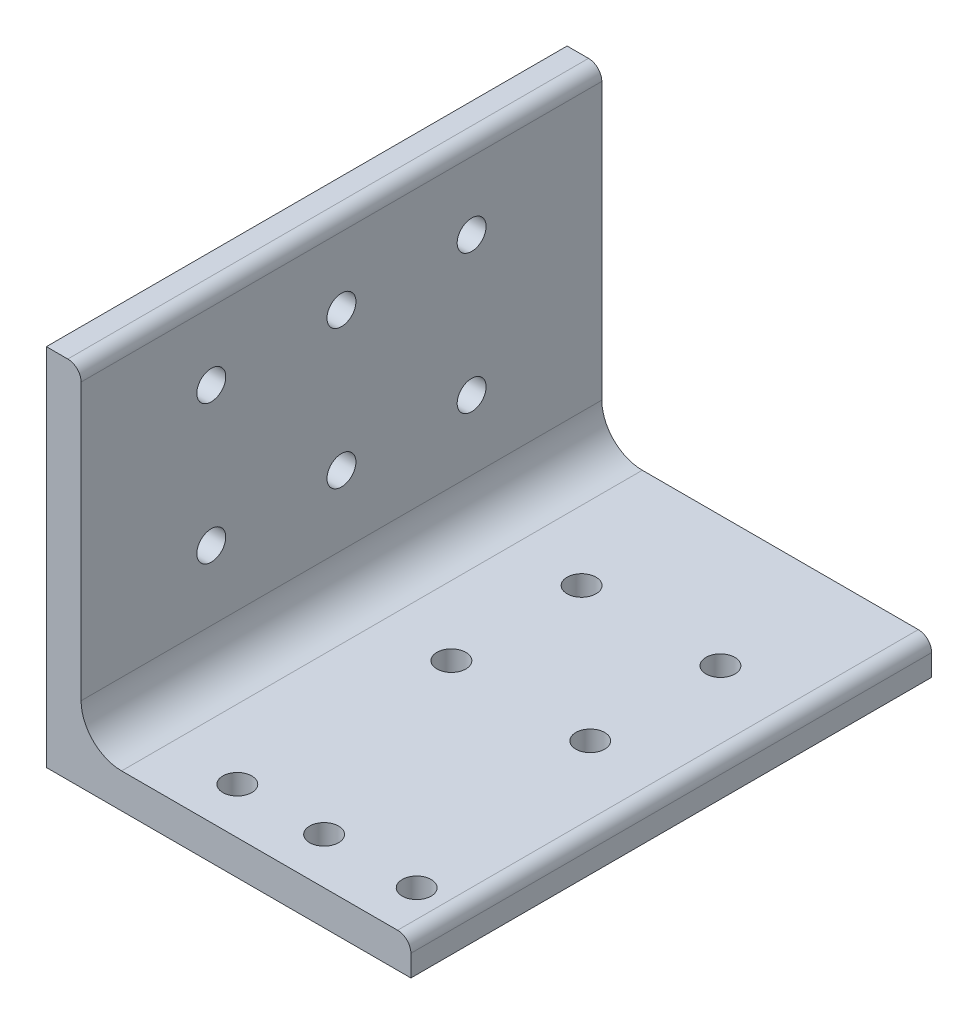
from build123d import *

# Parameters (mm, degrees)
AUFSATZ_LINEAR_AUSTRAGEN1_DEPTH = 90
F_5_0_5_DURCHMESSER_BOHRUNG1_D  = 5
F_5_0_5_DURCHMESSER_BOHRUNG2_D  = 5


with BuildPart() as part:
    # Skizze2 → Aufsatz-Linear austragen1 (new body)
    with BuildSketch(Plane.XY):
        with BuildLine():
            ThreePointArc((6, 13), (8.050252532, 8.050252532), (13, 6))
            Line((13, 6), (60.7, 6))
            ThreePointArc((60.7, 6), (62.326345597, 5.326345597), (63, 3.7))
            Line((63, 3.7), (63, 0))
            Line((63, 0), (0, 0))
            Line((0, 0), (0, 63))
            Line((0, 63), (3.7, 63))
            ThreePointArc((3.7, 63), (5.326345597, 62.326345597), (6, 60.7))
            Line((6, 60.7), (6, 13))
        make_face()
    extrude(amount=AUFSATZ_LINEAR_AUSTRAGEN1_DEPTH)

    # Ø5.0 (5) Durchmesser Bohrung1 (through all)
    with Locations(Plane(origin=(6, 25, 67.5), x_dir=(0, 1, 0), z_dir=(1, 0, 0))):
        with Locations((0, 0), (24, 0), (24, -22.5), (0, -22.5), (0, -45), (24, -45)):
            Hole(F_5_0_5_DURCHMESSER_BOHRUNG1_D / 2)

    # Ø5.0 (5) Durchmesser Bohrung2 (through all)
    with Locations(Plane(origin=(56, 6, 82), x_dir=(0, 0, 1), z_dir=(0, 1, 0))):
        with Locations((0, 0), (0, -16), (-59.5, -31), (-59.5, -7), (-37, -7), (-37, -31), (0, -31)):
            Hole(F_5_0_5_DURCHMESSER_BOHRUNG2_D / 2)


solid = part.part
